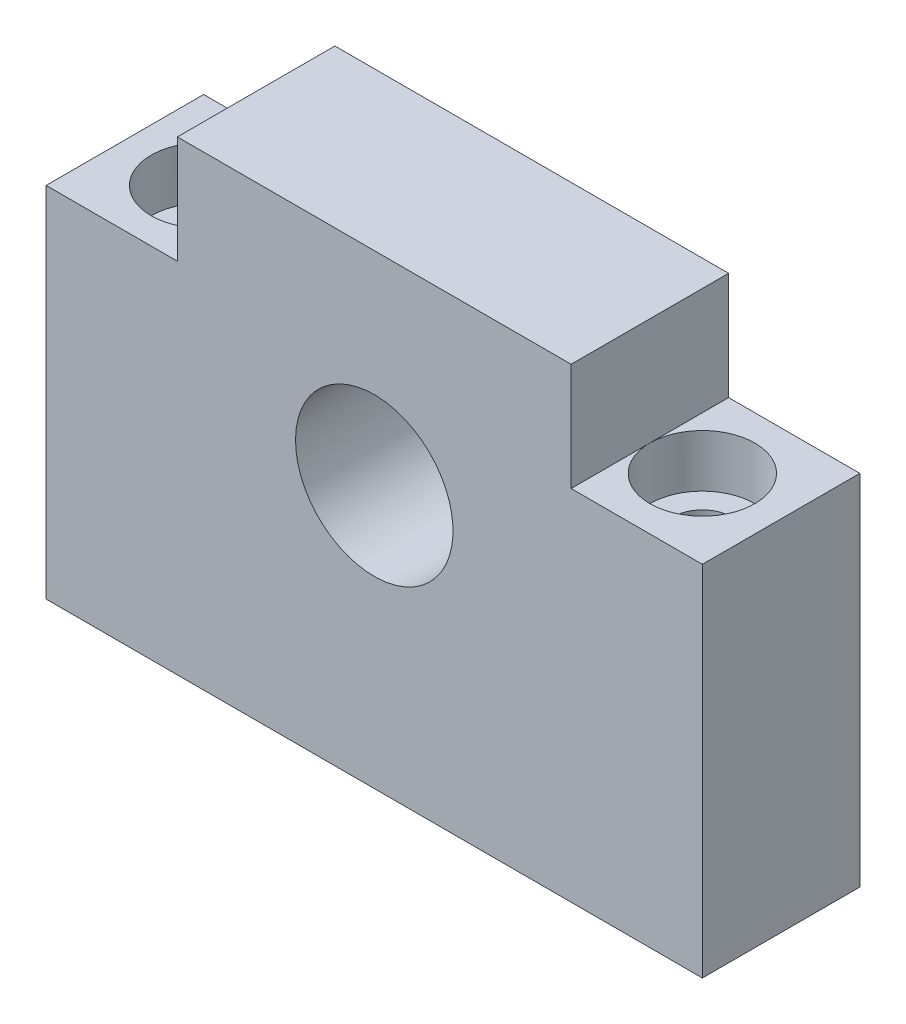
from build123d import *

# Parameters (mm, degrees)
SKETCH_1_W                   = 50
SKETCH_1_H                   = 27.3
EXTRUDE_1_DEPTH              = 12
SKETCH_2_W                   = 30
SKETCH_2_H                   = 30
EXTRUDE_2_DEPTH              = 12
SKETCH_3_R                   = 6
CUT_EXTRUDE_1_DEPTH          = 63.483997951
HOLE_WIZARD_M4_3_D           = 4.5
HOLE_WIZARD_M4_3_CBORE_D     = 8
HOLE_WIZARD_M4_3_CBORE_DEPTH = 4


with BuildPart() as part:
    # 스케치1 → 보스-돌출1 (new body)
    with BuildSketch(Plane.XY):
        with Locations((25, 13.65)):
            Rectangle(SKETCH_1_W, SKETCH_1_H)
    extrude(amount=EXTRUDE_1_DEPTH)

    # 스케치2 → 보스-돌출2 (add)
    with BuildSketch(Plane.XY.offset(12)):
        with Locations((25, 20.5)):
            Rectangle(SKETCH_2_W, SKETCH_2_H)
    extrude(amount=-EXTRUDE_2_DEPTH)

    # 스케치3 → 컷-돌출1 (cut, through all)
    with BuildSketch(Plane(origin=(0, 0, 0), x_dir=(-1, 0, 0), z_dir=(0, 0, -1))):
        with Locations((-25, 20)):
            Circle(SKETCH_3_R)
    extrude(amount=-CUT_EXTRUDE_1_DEPTH, mode=Mode.SUBTRACT)

    # M4 소켓 머리 캡 나사용 카운터보어3 (through all)
    with Locations(Plane(origin=(0, 27.3, 0), x_dir=(1, 0, 0), z_dir=(0, 1, 0))):
        with Locations((44, -6), (6, -6)):
            CounterBoreHole(HOLE_WIZARD_M4_3_D / 2, HOLE_WIZARD_M4_3_CBORE_D / 2, HOLE_WIZARD_M4_3_CBORE_DEPTH)


solid = part.part
